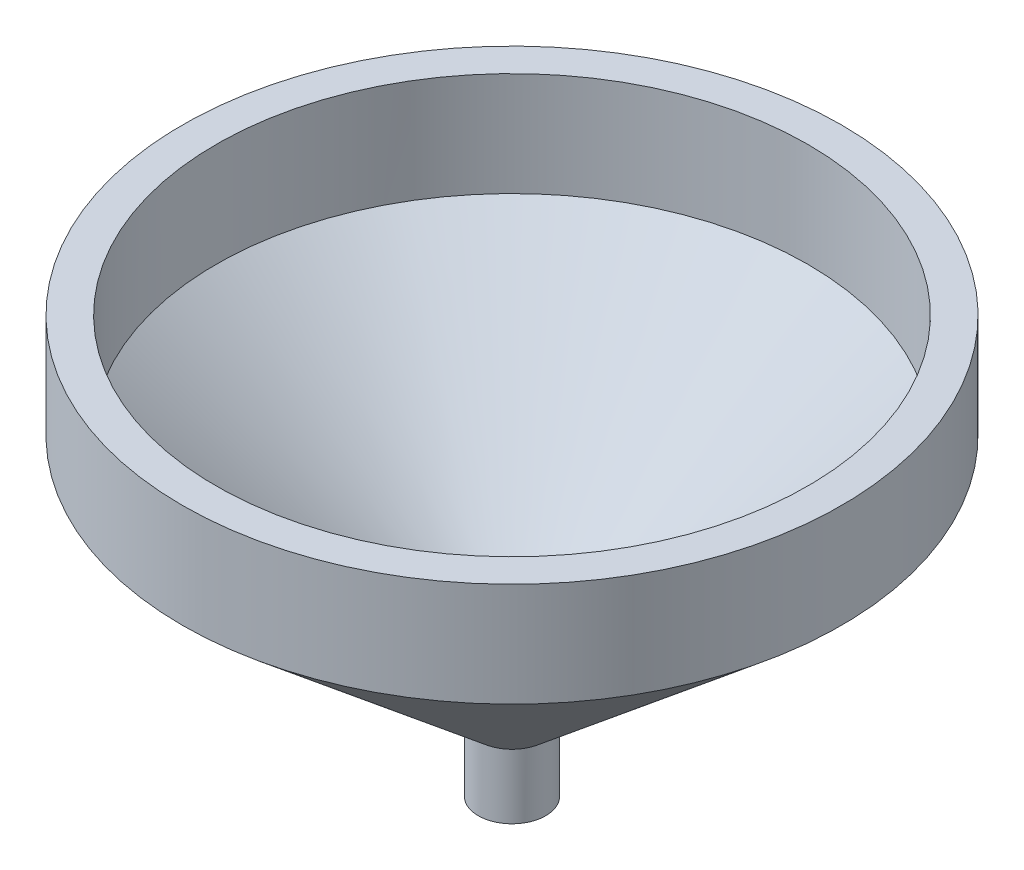
from build123d import *


with BuildPart() as part:
    # Sketch1 → Revolve1 (revolve)
    with BuildSketch(Plane(origin=(0, 0, 0), x_dir=(0, 0, -1), z_dir=(1, 0, 0))):
        Polygon((4, 0), (4, 6.686917441), (34.641777725, 32.398421828), (34.641777725, 43.155636842), (38.130604216, 43.155636842), (38.130604216, 32.398421828), (7.488826491, 6.686917441), (7.488826491, 0), align=None)
    revolve(axis=Axis((0, 0, -4), (0, 1, 0)))


solid = part.part
